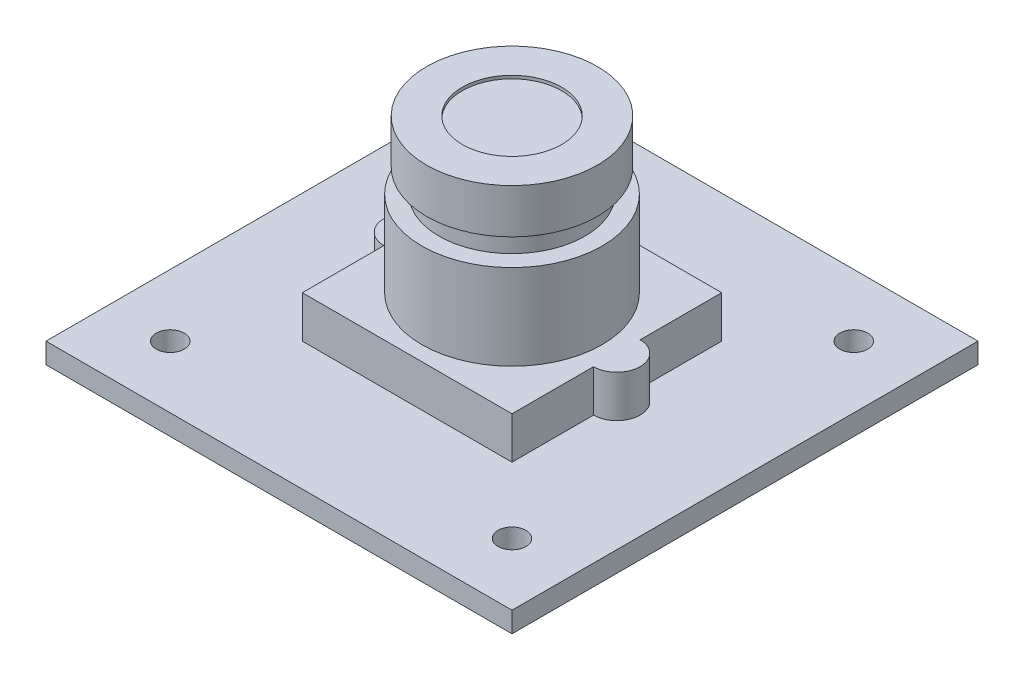
from build123d import *

# Parameters (mm, degrees)
SKETCH1_W           = 38.1
SKETCH1_H           = 38.1
SKETCH1_R           = 1.143
BOSS_EXTRUDE1_DEPTH = 1.6764
BOSS_EXTRUDE2_DEPTH = 3.429
SKETCH3_R           = 7.366
BOSS_EXTRUDE3_DEPTH = 6.985
SKETCH4_R           = 5.969
BOSS_EXTRUDE4_DEPTH = 1.905
SKETCH5_R           = 6.985
BOSS_EXTRUDE5_DEPTH = 3.6322
SKETCH6_R           = 4.064
CUT_EXTRUDE1_DEPTH  = 0.254
SKETCH7_W           = 10.033
SKETCH7_H           = 4.7244
SKETCH7_W_2         = 8.763
SKETCH7_H_2         = 3.4544
BOSS_EXTRUDE6_DEPTH = 6.604
CUT_EXTRUDE2_REACH  = 41.725
SKETCH9_W           = 3.175
SKETCH9_H           = 6.604


with BuildPart() as part:
    # Sketch1 → Boss-Extrude1 (new body)
    with BuildSketch(Plane(origin=(0, 0, 0), x_dir=(1, 0, 0), z_dir=(0, 1, 0))):
        Rectangle(SKETCH1_W, SKETCH1_H)
        with Locations(Location((-13.97, 13.97, 0), (0, 0, 270))):
            Circle(SKETCH1_R, mode=Mode.SUBTRACT)
        with Locations(Location((-13.97, -13.97, 0), (0, 0, 270))):
            Circle(SKETCH1_R, mode=Mode.SUBTRACT)
        with Locations(Location((13.97, -13.97, 0), (0, 0, 270))):
            Circle(SKETCH1_R, mode=Mode.SUBTRACT)
        with Locations(Location((13.97, 13.97, 0), (0, 0, 270))):
            Circle(SKETCH1_R, mode=Mode.SUBTRACT)
    extrude(amount=BOSS_EXTRUDE1_DEPTH)

    # Sketch2 → Boss-Extrude2 (add)
    with BuildSketch(Plane(origin=(0, 1.6764, 0), x_dir=(1, 0, 0), z_dir=(0, 1, 0))):
        with BuildLine():
            Line((-8.5725, -1.905), (-8.5725, -8.5725))
            Line((-8.5725, -8.5725), (8.5725, -8.5725))
            Line((8.5725, -8.5725), (8.5725, -1.905))
            ThreePointArc((8.5725, -1.905), (10.4775, 0), (8.5725, 1.905))
            Line((8.5725, 1.905), (8.5725, 8.5725))
            Line((8.5725, 8.5725), (-8.5725, 8.5725))
            Line((-8.5725, 8.5725), (-8.5725, 1.905))
            ThreePointArc((-8.5725, 1.905), (-10.4775, 0), (-8.5725, -1.905))
        make_face()
    extrude(amount=BOSS_EXTRUDE2_DEPTH)

    # Sketch3 → Boss-Extrude3 (add)
    with BuildSketch(Plane(origin=(0, 5.1054, 0), x_dir=(1, 0, 0), z_dir=(0, 1, 0))):
        with Locations(Location((0, 0, 0), (0, 0, 270))):
            Circle(SKETCH3_R)
    extrude(amount=BOSS_EXTRUDE3_DEPTH)

    # Sketch4 → Boss-Extrude4 (add)
    with BuildSketch(Plane(origin=(0, 12.0904, 0), x_dir=(1, 0, 0), z_dir=(0, 1, 0))):
        with Locations(Location((0, 0, 0), (0, 0, 90))):
            Circle(SKETCH4_R)
    extrude(amount=BOSS_EXTRUDE4_DEPTH)

    # Sketch5 → Boss-Extrude5 (add)
    with BuildSketch(Plane(origin=(0, 13.9954, 0), x_dir=(1, 0, 0), z_dir=(0, 1, 0))):
        with Locations(Location((0, 0, 0), (0, 0, 270))):
            Circle(SKETCH5_R)
    extrude(amount=BOSS_EXTRUDE5_DEPTH)

    # Sketch6 → Cut-Extrude1 (cut)
    with BuildSketch(Plane(origin=(0, 17.6276, 0), x_dir=(1, 0, 0), z_dir=(0, 1, 0))):
        with Locations(Location((0, 0, 0), (0, 0, 270))):
            Circle(SKETCH6_R)
    extrude(amount=-CUT_EXTRUDE1_DEPTH, mode=Mode.SUBTRACT)

    # Sketch7 → Boss-Extrude6 (add)
    with BuildSketch(Plane.XZ):
        with Locations((-6.2865, -13.3858)):
            Rectangle(SKETCH7_W, SKETCH7_H)
        with Locations((-6.2865, -13.3858)):
            Rectangle(SKETCH7_W_2, SKETCH7_H_2, mode=Mode.SUBTRACT)
    extrude(amount=BOSS_EXTRUDE6_DEPTH)

    # Sketch9 → Cut-Extrude2 (cut, up to next)
    with BuildSketch(Plane.XY.offset(-11.0236), mode=Mode.PRIVATE) as cut_extrude2_sk1:
        with Locations((-6.2865, -3.302)):
            Rectangle(SKETCH9_W, SKETCH9_H)
    cut_extrude2_tool1 = extrude(cut_extrude2_sk1.sketch, amount=-CUT_EXTRUDE2_REACH, mode=Mode.PRIVATE) & part.part
    add(cut_extrude2_tool1.solids().sort_by_distance((-6.2865, -3.302, -11.0236))[0], mode=Mode.SUBTRACT)


solid = part.part
